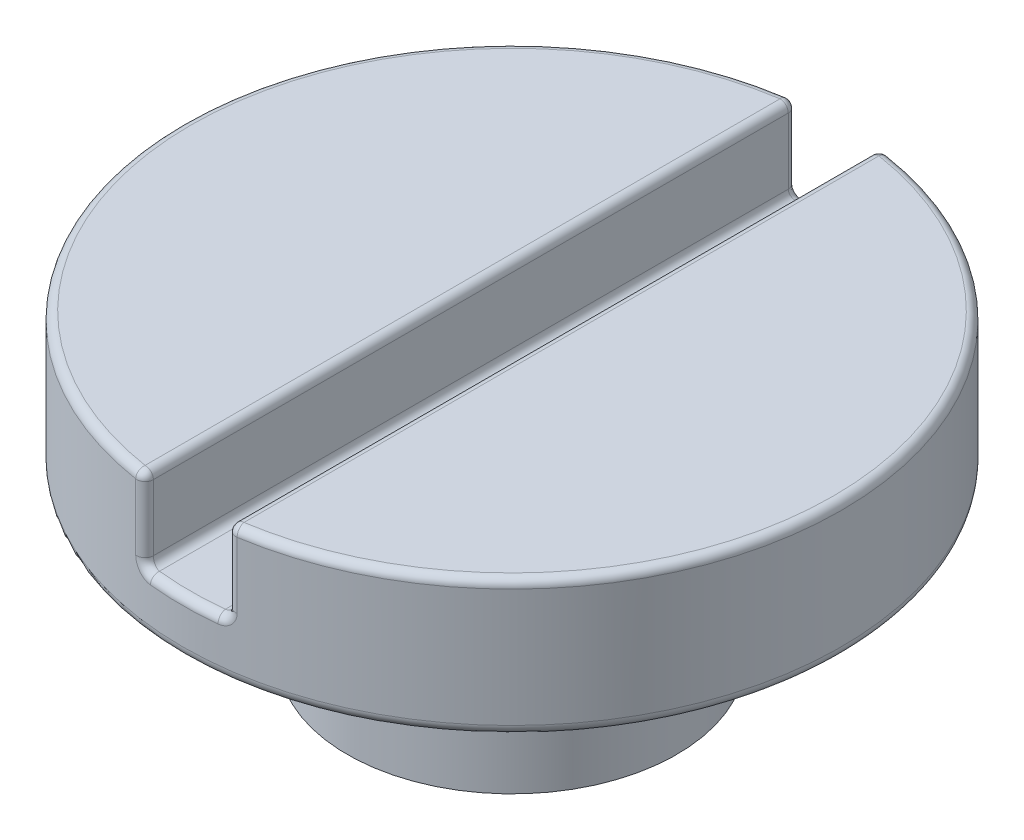
from build123d import *

# Parameters (mm, degrees)
SKETCH2_R           = 60
BOSS_EXTRUDE1_DEPTH = 25
SKETCH3_R           = 30
BOSS_EXTRUDE2_DEPTH = 30
SKETCH4_R           = 15
CUT_EXTRUDE1_DEPTH  = 30
SKETCH5_W           = 10
SKETCH5_H           = 8
CUT_EXTRUDE2_DEPTH  = 30
SKETCH6_W           = 15
SKETCH6_H           = 130
CUT_EXTRUDE3_DEPTH  = 15
FILLET1_R           = 2
FILLET2_R           = 1.5


with BuildPart() as part:
    # Sketch2 → Boss-Extrude1 (new body)
    with BuildSketch(Plane(origin=(0, 0, 0), x_dir=(-1, 0, 0), z_dir=(0, 1, 0))):
        with Locations(Location((0, 0, 0), (0, 0, 90))):
            Circle(SKETCH2_R)
    extrude(amount=BOSS_EXTRUDE1_DEPTH)

    # Sketch3 → Boss-Extrude2 (add)
    with BuildSketch(Plane.XZ):
        with Locations(Location((0, 0, 0), (0, 0, 270))):
            Circle(SKETCH3_R)
    extrude(amount=BOSS_EXTRUDE2_DEPTH)

    # Sketch4 → Cut-Extrude1 (cut)
    with BuildSketch(Plane.XZ.offset(30)):
        with Locations(Location((0, 0, 0), (0, 0, 270))):
            Circle(SKETCH4_R)
    extrude(amount=-CUT_EXTRUDE1_DEPTH, mode=Mode.SUBTRACT)

    # Sketch5 → Cut-Extrude2 (cut)
    with BuildSketch(Plane.XZ.offset(30)):
        with Locations((0, 15)):
            Rectangle(SKETCH5_W, SKETCH5_H)
    extrude(amount=-CUT_EXTRUDE2_DEPTH, mode=Mode.SUBTRACT)

    # Sketch6 → Cut-Extrude3 (cut)
    with BuildSketch(Plane(origin=(0, 25, 0), x_dir=(-1, 0, 0), z_dir=(0, 1, 0))):
        Rectangle(SKETCH6_W, SKETCH6_H)
    extrude(amount=-CUT_EXTRUDE3_DEPTH, mode=Mode.SUBTRACT)

    # Fillet1
    fillet1_edges = [part.edges().sort_by_distance(p)[0] for p in [
        (0, 0, -60),
    ]]
    fillet(fillet1_edges, radius=FILLET1_R)

    # Fillet2
    fillet2_edges = [part.edges().sort_by_distance(p)[0] for p in [
        (-60, 25, 0),
        (7.5, 25, 0),
        (-7.5, 25, 0),
        (0, 10, -60),
        (3.757374753, 10, 59.882235554),
        (-7.5, 17.5, -59.529404499),
        (-7.5, 10, 0),
        (-7.5, 17.5, 59.529404499),
        (7.5, 17.5, 59.529404499),
        (7.5, 10, 0),
        (7.5, 17.5, -59.529404499),
        (60, 25, 0),
    ]]
    fillet(fillet2_edges, radius=FILLET2_R)


solid = part.part
